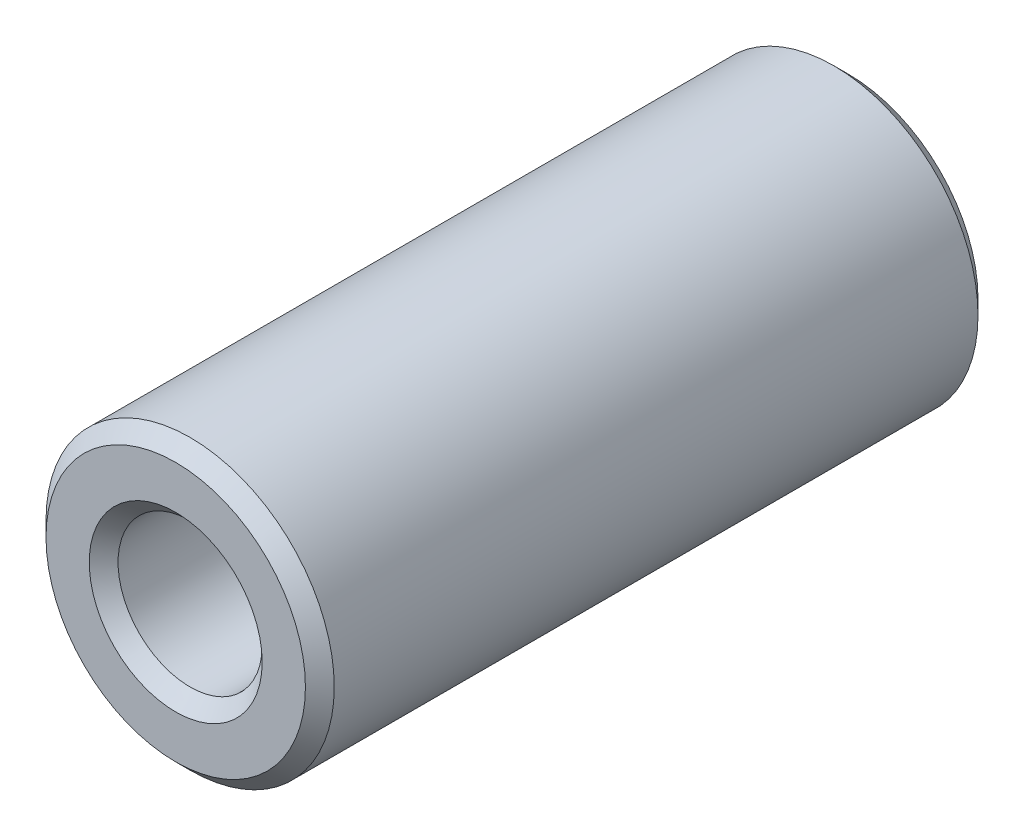
from build123d import *

# Parameters (mm, degrees)
SKETCH_1_R      = 3
SKETCH_1_R_2    = 1.5
EXTRUDE_1_DEPTH = 14
CHAMFER_1_SIZE  = 0.3


with BuildPart() as part:
    # ｽｹｯﾁ1 → ﾎﾞｽ - 押し出し1 (new body)
    with BuildSketch(Plane.XY):
        Circle(SKETCH_1_R)
        Circle(SKETCH_1_R_2, mode=Mode.SUBTRACT)
    extrude(amount=EXTRUDE_1_DEPTH)

    # 面取り1
    chamfer_1_edges = [part.edges().sort_by_distance(p)[0] for p in [
        (-3, 0, 0),
        (-3, 0, 14),
        (-1.5, 0, 0),
        (-1.5, 0, 14),
    ]]
    chamfer(chamfer_1_edges, length=CHAMFER_1_SIZE)


solid = part.part
